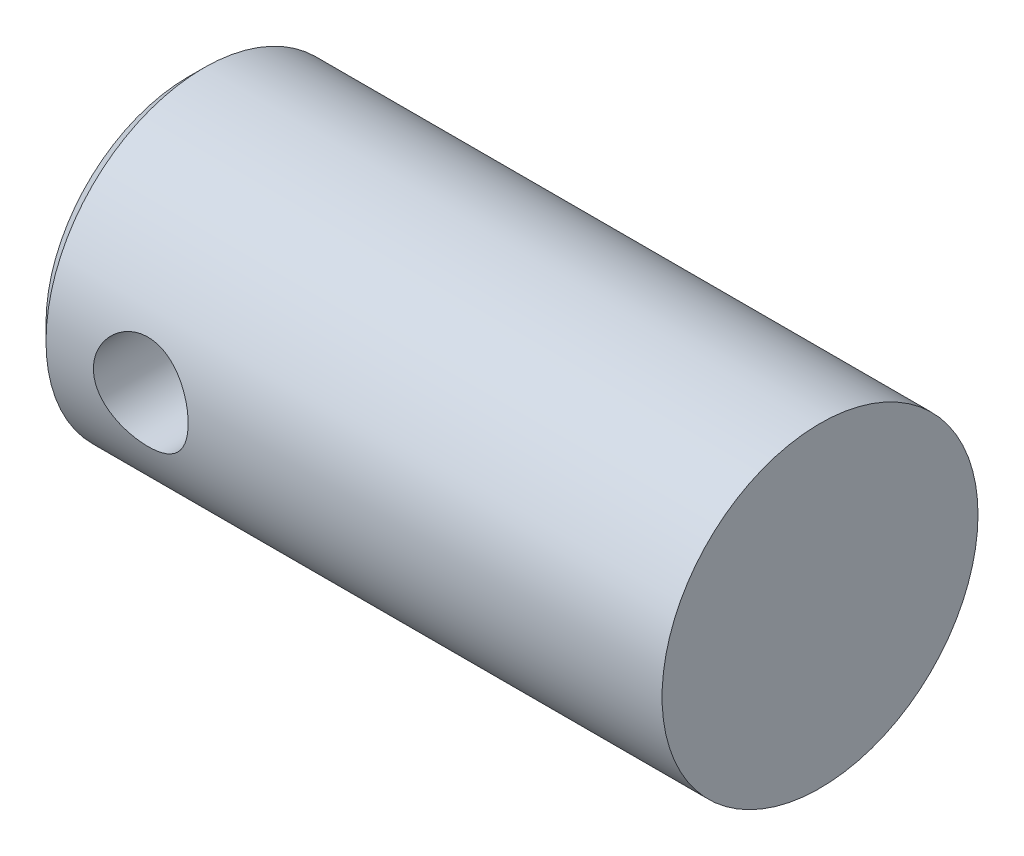
from build123d import *

# Parameters (mm, degrees)
ESQUISSE1_W           = 20
ESQUISSE1_H           = 5
CHANFREIN1_SIZE       = 0.5
EXTRUSION1_DEPTH      = 22.213203436
EXTRUSION1_DEPTH_BACK = 22.213203436
ESQUISSE2_R           = 1.5


with BuildPart() as part:
    # Esquisse1 → Base-Révolution (revolve)
    with BuildSketch(Plane.XY, mode=Mode.PRIVATE) as base_r_volution_sk:
        with Locations((-10, 2.5)):
            Rectangle(ESQUISSE1_W, ESQUISSE1_H)
    revolve(base_r_volution_sk.sketch.rotate(Axis((0, 0, 0), (-1, 0, 0)), 90), axis=Axis((0, 0, 0), (-1, 0, 0)))

    # Chanfrein1
    chanfrein1_edges = [part.edges().sort_by_distance(p)[0] for p in [
        (-20, 0, 5),
    ]]
    chamfer(chanfrein1_edges, length=CHANFREIN1_SIZE)

    # Esquisse2 → Extrusion1 (cut, two sides: drawn at the far end of the back side and taken through both)
    with BuildSketch(Plane.XY.offset(-EXTRUSION1_DEPTH_BACK)):
        with Locations((-16.5, 0)):
            Circle(ESQUISSE2_R)
    extrude(amount=EXTRUSION1_DEPTH + EXTRUSION1_DEPTH_BACK, mode=Mode.SUBTRACT)


solid = part.part
